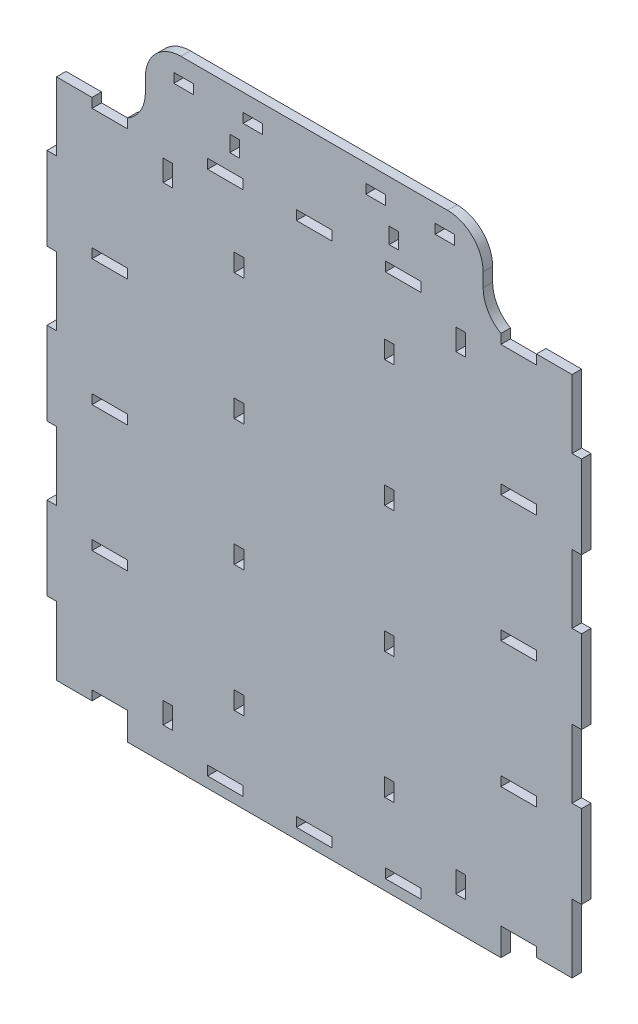
from build123d import *

# Parameters (mm, degrees)
MODEL_W             = 10.99999994
MODEL_H             = 5.349999293
MODEL_W_2           = 5.350001157
MODEL_H_2           = 10.000001639
MODEL_H_3           = 9.999997913
MODEL_H_4           = 10.000005364
MODEL_H_5           = 9.999990463
MODEL_W_3           = 19.999999553
MODEL_H_6           = 5.350001156
MODEL_H_7           = 5.349993706
MODEL_H_8           = 5.350008607
MODEL_W_4           = 5.350001156
MODEL_H_9           = 8.999999612
MODEL_W_5           = 5.350004882
MODEL_H_10          = 12.000000104
MODEL_W_6           = 19.999988377
MODEL_W_7           = 19.999995828
MODEL_H_11          = 5.349999992
MODEL_H_12          = 11.999994516
MODEL_W_8           = 10.999999941
BOSS_EXTRUDE1_DEPTH = 5.35


with BuildPart() as part:
    # Model → Boss-Extrude1 (new body)
    with BuildSketch(Plane.XY):
        with BuildLine():
            Line((295.349999331, 304.108172655), (295.349999331, 265.608172864))
            Line((295.349999331, 265.608172864), (300.699999556, 265.608172864))
            Line((300.699999556, 265.608172864), (300.699999556, 218.941502273))
            Line((300.699999556, 218.941502273), (295.349999331, 218.941502273))
            Line((295.349999331, 218.941502273), (295.349999331, 180.441506207))
            Line((295.349999331, 180.441506207), (300.699999556, 180.441506207))
            Line((300.699999556, 180.441506207), (300.699999556, 133.774831891))
            Line((300.699999556, 133.774831891), (295.349999331, 133.774831891))
            Line((295.349999331, 133.774831891), (295.349999331, 95.274835825))
            Line((295.349999331, 95.274835825), (300.699999556, 95.274835825))
            Line((300.699999556, 95.274835825), (300.699999556, 48.608183861))
            Line((300.699999556, 48.608183861), (295.349999331, 48.608183861))
            Line((295.349999331, 48.608183861), (295.349999331, 10.108172894))
            Line((295.349999331, 10.108172894), (275.349999778, 10.108172894))
            Line((275.349999778, 10.108172894), (275.349999778, 15.458166599))
            Line((275.349999778, 15.458166599), (255.350000225, 15.458166599))
            Line((255.350000225, 15.458166599), (255.350000225, 0))
            Line((255.350000225, 0), (45.349999331, 0))
            Line((45.349999331, 0), (45.349999331, 15.458166599))
            Line((45.349999331, 15.458166599), (25.349999778, 15.458166599))
            Line((25.349999778, 15.458166599), (25.349999778, 10.108172894))
            Line((25.349999778, 10.108172894), (5.350000225, 10.108172894))
            Line((5.350000225, 10.108172894), (5.350000225, 48.608183861))
            Line((5.350000225, 48.608183861), (0, 48.608183861))
            Line((0, 48.608183861), (0, 95.274835825))
            Line((0, 95.274835825), (5.350000225, 95.274835825))
            Line((5.350000225, 95.274835825), (5.350000225, 133.774831891))
            Line((5.350000225, 133.774831891), (0, 133.774831891))
            Line((0, 133.774831891), (0, 180.441506207))
            Line((0, 180.441506207), (5.350000225, 180.441506207))
            Line((5.350000225, 180.441506207), (5.350000225, 218.941502273))
            Line((5.350000225, 218.941502273), (0, 218.941502273))
            Line((0, 218.941502273), (0, 265.608172864))
            Line((0, 265.608172864), (5.350000225, 265.608172864))
            Line((5.350000225, 265.608172864), (5.350000225, 304.108172655))
            Line((5.350000225, 304.108172655), (25.349999778, 304.108172655))
            Line((25.349999778, 304.108172655), (25.349999778, 298.75817243))
            Line((25.349999778, 298.75817243), (45.349999331, 298.75817243))
            Line((45.349999331, 298.75817243), (45.349999331, 304.108172655))
            ThreePointArc((45.349999331, 304.108172655), (52.670508573, 311.428680858), (55.35000097, 321.428681677))
            Line((55.35000097, 321.428681677), (55.35000097, 329.108174443))
            ThreePointArc((55.35000097, 329.108174443), (61.207865188, 343.250309909), (75.350000523, 349.108174443))
            Line((75.350000523, 349.108174443), (225.349999033, 349.108174443))
            ThreePointArc((225.349999033, 349.108174443), (239.492134368, 343.250309909), (245.349998586, 329.108174443))
            Line((245.349998586, 329.108174443), (245.349998586, 321.428681677))
            ThreePointArc((245.349998586, 321.428681677), (248.029490983, 311.428680858), (255.350000225, 304.108172655))
            Line((255.350000225, 304.108172655), (255.350000225, 298.75817243))
            Line((255.350000225, 298.75817243), (275.349999778, 298.75817243))
            Line((275.349999778, 298.75817243), (275.349999778, 304.108172655))
            Line((275.349999778, 304.108172655), (295.349999331, 304.108172655))
        make_face()
        with Locations((223.849999718, 336.625010707)):
            Rectangle(MODEL_W, MODEL_H, mode=Mode.SUBTRACT)
        with Locations((184.850002639, 336.625010707)):
            Rectangle(MODEL_W, MODEL_H, mode=Mode.SUBTRACT)
        with Locations((108.025002294, 263.726172969)):
            Rectangle(MODEL_W_2, MODEL_H_2, mode=Mode.SUBTRACT)
        with Locations((108.025002294, 192.647505552)):
            Rectangle(MODEL_W_2, MODEL_H_3, mode=Mode.SUBTRACT)
        with Locations((108.025002294, 121.568836272)):
            Rectangle(MODEL_W_2, MODEL_H_4, mode=Mode.SUBTRACT)
        with Locations((108.025002294, 50.490170718)):
            Rectangle(MODEL_W_2, MODEL_H_5, mode=Mode.SUBTRACT)
        with Locations((35.349999555, 228.186842054)):
            Rectangle(MODEL_W_3, MODEL_H_6, mode=Mode.SUBTRACT)
        with Locations((35.349999555, 157.108172774)):
            Rectangle(MODEL_W_3, MODEL_H_7, mode=Mode.SUBTRACT)
        with Locations((35.349999555, 86.02950722)):
            Rectangle(MODEL_W_3, MODEL_H_8, mode=Mode.SUBTRACT)
        with Locations((105.524997227, 320.450009778)):
            Rectangle(MODEL_W_4, MODEL_H_9, mode=Mode.SUBTRACT)
        with Locations((68.025001325, 288.600009866)):
            Rectangle(MODEL_W_5, MODEL_H_10, mode=Mode.SUBTRACT)
        with Locations((150.349999777, 8.675009012)):
            Rectangle(MODEL_W_6, MODEL_H_7, mode=Mode.SUBTRACT)
        with Locations((200.350000523, 8.675009012)):
            Rectangle(MODEL_W_7, MODEL_H_7, mode=Mode.SUBTRACT)
        with Locations((100.349999033, 304.275010363)):
            Rectangle(MODEL_W_7, MODEL_H_11, mode=Mode.SUBTRACT)
        with Locations((150.349999777, 304.275010363)):
            Rectangle(MODEL_W_6, MODEL_H_11, mode=Mode.SUBTRACT)
        with Locations((232.674998231, 24.350002408)):
            Rectangle(MODEL_W_5, MODEL_H_12, mode=Mode.SUBTRACT)
        with Locations((68.025001325, 24.350002408)):
            Rectangle(MODEL_W_5, MODEL_H_12, mode=Mode.SUBTRACT)
        with Locations((100.349999033, 8.675009012)):
            Rectangle(MODEL_W_7, MODEL_H_7, mode=Mode.SUBTRACT)
        with Locations((200.350000523, 304.275010363)):
            Rectangle(MODEL_W_7, MODEL_H_11, mode=Mode.SUBTRACT)
        with Locations((232.674998231, 288.600009866)):
            Rectangle(MODEL_W_5, MODEL_H_10, mode=Mode.SUBTRACT)
        with Locations((115.849996917, 336.625010707)):
            Rectangle(MODEL_W, MODEL_H, mode=Mode.SUBTRACT)
        with Locations((76.849999838, 336.625010707)):
            Rectangle(MODEL_W_8, MODEL_H, mode=Mode.SUBTRACT)
        with Locations((195.175002329, 320.450009778)):
            Rectangle(MODEL_W_4, MODEL_H_9, mode=Mode.SUBTRACT)
        with Locations((265.350000002, 86.02950722)):
            Rectangle(MODEL_W_3, MODEL_H_8, mode=Mode.SUBTRACT)
        with Locations((265.350000002, 157.108172774)):
            Rectangle(MODEL_W_3, MODEL_H_7, mode=Mode.SUBTRACT)
        with Locations((265.350000002, 228.186842054)):
            Rectangle(MODEL_W_3, MODEL_H_6, mode=Mode.SUBTRACT)
        with Locations((192.674997263, 50.490170718)):
            Rectangle(MODEL_W_2, MODEL_H_5, mode=Mode.SUBTRACT)
        with Locations((192.674997263, 121.568836272)):
            Rectangle(MODEL_W_2, MODEL_H_4, mode=Mode.SUBTRACT)
        with Locations((192.674997263, 192.647505552)):
            Rectangle(MODEL_W_2, MODEL_H_3, mode=Mode.SUBTRACT)
        with Locations((192.674997263, 263.726172969)):
            Rectangle(MODEL_W_2, MODEL_H_2, mode=Mode.SUBTRACT)
    extrude(amount=BOSS_EXTRUDE1_DEPTH)


solid = part.part
